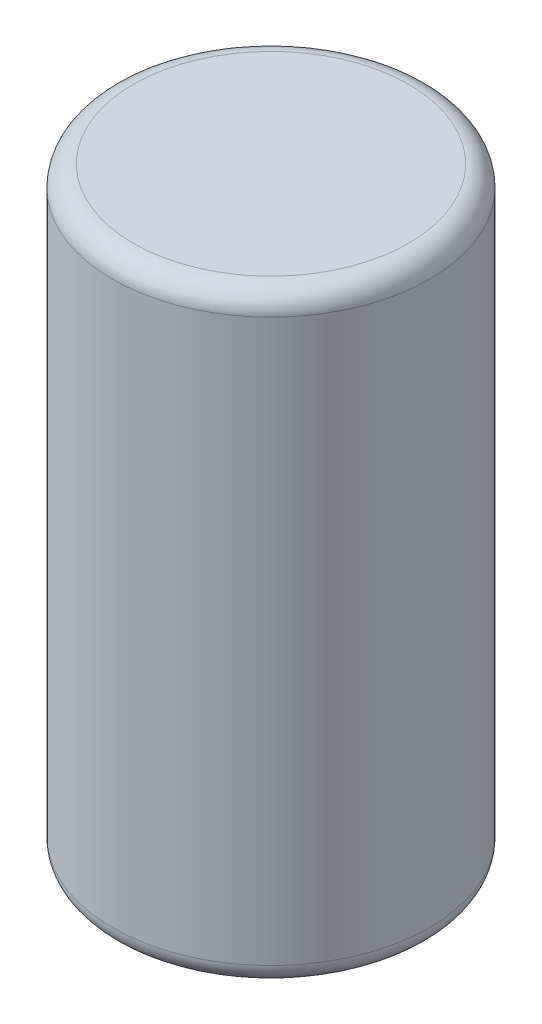
from build123d import *

# Parameters (mm, degrees)
SKETCH2_R           = 76.2
BOSS_EXTRUDE1_DEPTH = 290
FILLET1_R           = 10


with BuildPart() as part:
    # Sketch2 → Boss-Extrude1 (new body)
    with BuildSketch(Plane(origin=(0, 0, 0), x_dir=(1, 0, 0), z_dir=(0, 1, 0))):
        with Locations(Location((0, 0, 0), (0, 0, 270))):
            Circle(SKETCH2_R)
    extrude(amount=BOSS_EXTRUDE1_DEPTH)

    # Fillet1
    fillet1_edges = [part.edges().sort_by_distance(p)[0] for p in [
        (0, 0, -76.2),
        (0, 290, -76.2),
    ]]
    fillet(fillet1_edges, radius=FILLET1_R)


solid = part.part
